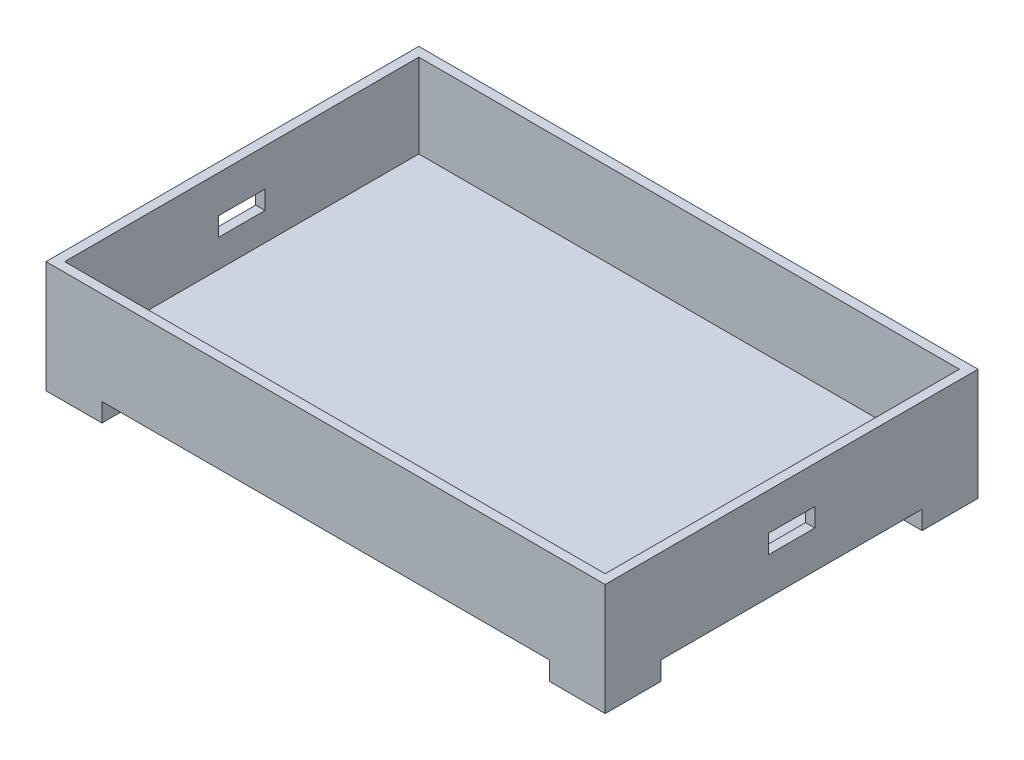
from build123d import *

# Parameters (mm, degrees)
CROQUIS1_W              = 60
CROQUIS1_H              = 40
SALIENTE_EXTRUIR1_DEPTH = 10
VACIADO3_T              = -1
CROQUIS3_W              = 5
CROQUIS3_H              = 2
CORTAR_EXTRUIR1_DEPTH   = 65.031242374
CROQUIS4_W              = 6
CROQUIS4_H              = 6
SALIENTE_EXTRUIR2_DEPTH = 2


with BuildPart() as part:
    # Croquis1 → Saliente-Extruir1 (new body)
    with BuildSketch(Plane(origin=(0, 0, 0), x_dir=(1, 0, 0), z_dir=(0, 1, 0))):
        Rectangle(CROQUIS1_W, CROQUIS1_H)
    extrude(amount=SALIENTE_EXTRUIR1_DEPTH)

    # Vaciado3
    vaciado3_openings = [part.faces().sort_by_distance(p)[0] for p in [
        (0, 10, 0),
    ]]
    offset(amount=VACIADO3_T, openings=vaciado3_openings, kind=Kind.INTERSECTION)

    # Croquis3 → Cortar-Extruir1 (cut, through all)
    with BuildSketch(Plane.ZY.offset(30)):
        with Locations((0, 5)):
            Rectangle(CROQUIS3_W, CROQUIS3_H)
    extrude(amount=-CORTAR_EXTRUIR1_DEPTH, mode=Mode.SUBTRACT)

    # Croquis4 → Saliente-Extruir2 (add)
    with BuildSketch(Plane.XZ):
        with Locations((-27, 17)):
            Rectangle(CROQUIS4_W, CROQUIS4_H)
        with Locations((-27, -17)):
            Rectangle(CROQUIS4_W, CROQUIS4_H)
        with Locations((27, -17)):
            Rectangle(CROQUIS4_W, CROQUIS4_H)
        with Locations((27, 17)):
            Rectangle(CROQUIS4_W, CROQUIS4_H)
    extrude(amount=SALIENTE_EXTRUIR2_DEPTH)


solid = part.part
